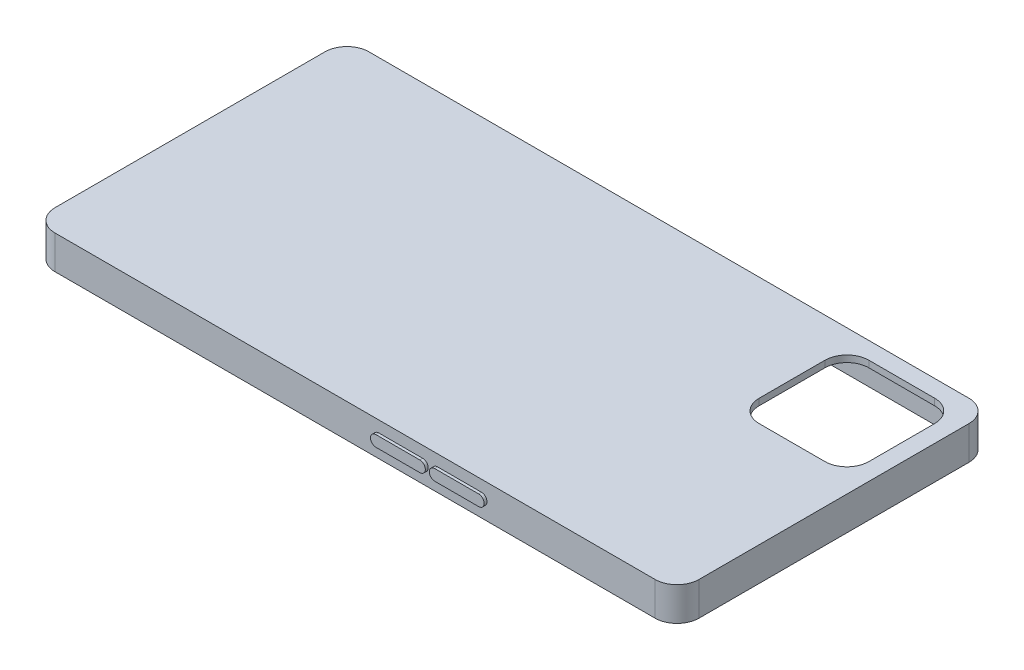
from build123d import *

# Parameters (mm, degrees)
SKETCH1_W                 = 146.7
SKETCH1_H                 = 71.5
BASE_DEPTH                = 7.65
CURVES_CASE_R             = 5
SHELL_T                   = -1.5
CAMERA_HOLE_DEPTH         = 82.956131558
CAMERA_HOLE_DEPTH_BACK    = 82.956131558
SKETCH2_W                 = 25
SKETCH2_H                 = 25
CURVES_CAMERA_R           = 5
CHARGER_BOTTOM_DEPTH      = 152.186887659
CHARGER_BOTTOM_DEPTH_BACK = 9.65
VOLUME_BOTTOM_DEPTH       = 0.65
TURN_ON_OFF_DEPTH         = 0.65


with BuildPart() as part:
    # Sketch1 → Base (new body)
    with BuildSketch(Plane(origin=(0, 0, 0), x_dir=(1, 0, 0), z_dir=(0, 1, 0))):
        Rectangle(SKETCH1_W, SKETCH1_H)
    extrude(amount=BASE_DEPTH)

    # Curves case
    curves_case_edges = [part.edges().sort_by_distance(p)[0] for p in [
        (73.35, 3.825, 35.75),
        (-73.35, 3.825, 35.75),
        (-73.35, 3.825, -35.75),
        (73.35, 3.825, -35.75),
    ]]
    fillet(curves_case_edges, radius=CURVES_CASE_R)

    # Shell
    shell_openings = [part.faces().sort_by_distance(p)[0] for p in [
        (0, 0, 0),
    ]]
    offset(amount=SHELL_T, openings=shell_openings, kind=Kind.INTERSECTION)

    # Sketch2 → Camera Hole (cut, two sides: drawn at the far end of the back side and taken through both)
    with BuildSketch(Plane(origin=(0, 7.65, 0), x_dir=(1, 0, 0), z_dir=(0, 1, 0)).offset(-CAMERA_HOLE_DEPTH_BACK)):
        with Locations((56.945704346, 19.35)):
            Rectangle(SKETCH2_W, SKETCH2_H)
    extrude(amount=CAMERA_HOLE_DEPTH + CAMERA_HOLE_DEPTH_BACK, mode=Mode.SUBTRACT)

    # Curves Camera
    curves_camera_edges = [part.edges().sort_by_distance(p)[0] for p in [
        (69.445704346, 6.9, -31.85),
        (69.445704346, 6.9, -6.85),
        (44.445704346, 6.9, -6.85),
        (44.445704346, 6.9, -31.85),
    ]]
    fillet(curves_camera_edges, radius=CURVES_CAMERA_R)

    # Sketch6 → Charger bottom (cut, two sides: drawn at the far end of the back side and taken through both)
    with BuildSketch(Plane.ZY.offset(73.35).offset(-CHARGER_BOTTOM_DEPTH_BACK)):
        with BuildLine():
            Line((-2.425, 4.722712559), (2.425, 4.722712559))
            ThreePointArc((2.425, 4.722712559), (4.087430665, 3.060281894), (2.425, 1.397851228))
            Line((2.425, 1.397851228), (-2.425, 1.397851228))
            ThreePointArc((-2.425, 1.397851228), (-4.087430665, 3.060281894), (-2.425, 4.722712559))
        make_face()
    extrude(amount=CHARGER_BOTTOM_DEPTH + CHARGER_BOTTOM_DEPTH_BACK, mode=Mode.SUBTRACT)

    # Sketch9 → Volume Bottom (add)
    with BuildSketch(Plane.XY.offset(35.75)):
        with BuildLine():
            Line((5.40710355, 5.075), (15.40710355, 5.075))
            ThreePointArc((15.40710355, 5.075), (16.65710355, 3.825), (15.40710355, 2.575))
            Line((15.40710355, 2.575), (5.40710355, 2.575))
            ThreePointArc((5.40710355, 2.575), (4.15710355, 3.825), (5.40710355, 5.075))
        make_face()
        with BuildLine():
            Line((18.803853298, 5.075), (28.803853298, 5.075))
            ThreePointArc((28.803853298, 5.075), (30.053853298, 3.825), (28.803853298, 2.575))
            Line((28.803853298, 2.575), (18.803853298, 2.575))
            ThreePointArc((18.803853298, 2.575), (17.553853298, 3.825), (18.803853298, 5.075))
        make_face()
    extrude(amount=VOLUME_BOTTOM_DEPTH)

    # Sketch11 → Turn on/off (add)
    with BuildSketch(Plane(origin=(0, 0, -35.75), x_dir=(-1, 0, 0), z_dir=(0, 0, -1))):
        with BuildLine():
            Line((-20.994631551, 5.075), (-6.504836948, 5.075))
            ThreePointArc((-6.504836948, 5.075), (-5.254836948, 3.825), (-6.504836948, 2.575))
            Line((-6.504836948, 2.575), (-20.994631551, 2.575))
            ThreePointArc((-20.994631551, 2.575), (-22.244631551, 3.825), (-20.994631551, 5.075))
        make_face()
    extrude(amount=TURN_ON_OFF_DEPTH)


solid = part.part
